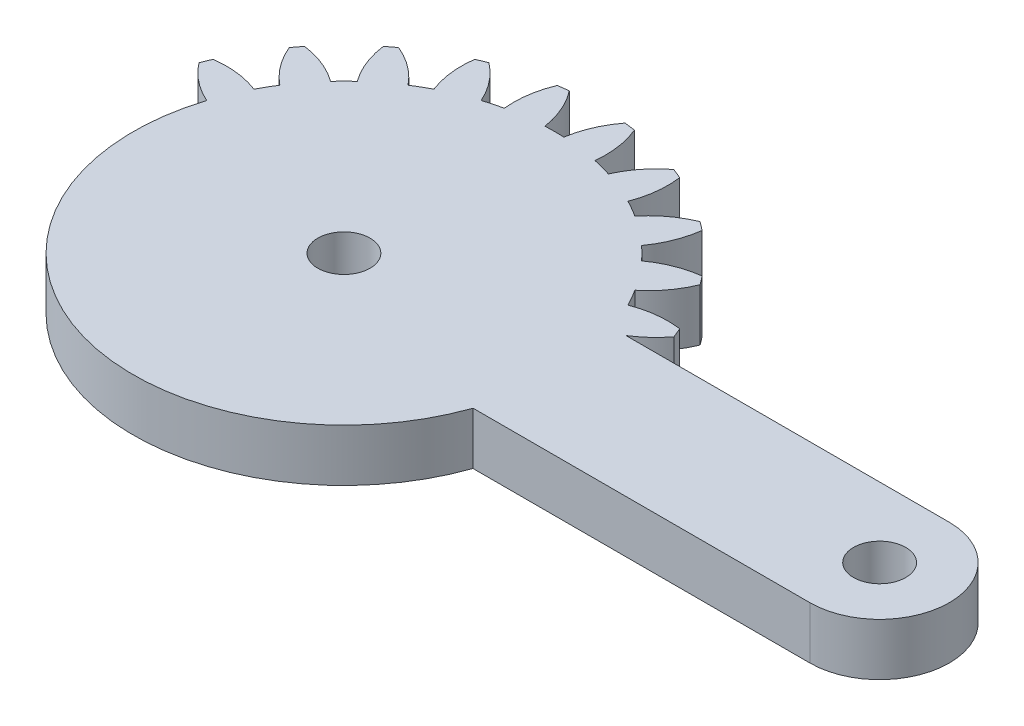
from build123d import *
from build123d.topology import SkipClean

# Parameters (mm, degrees)
SKETCH1_R           = 1.5
BOSS_EXTRUDE1_DEPTH = 3
CUT_EXTRUDE1_START  = -10
CUT_EXTRUDE1_DEPTH  = 10
SCALE1_SCALE        = 2


with BuildPart() as part:
    # Sketch1 → Boss-Extrude1 (new body)
    with BuildSketch(Plane(origin=(0, 0, 0), x_dir=(1, 0, 0), z_dir=(0, 1, 0))):
        with BuildLine():
            Line((20.643657446, 4), (2.081641936, 4))
            ThreePointArc((2.081641936, 4), (2.861028333, 4.588201733), (3.521749436, 5.30713988))
            ThreePointArc((3.521749436, 5.30713988), (3.405395609, 5.596745198), (3.282888305, 5.883801663))
            ThreePointArc((3.282888305, 5.883801663), (1.93527598, 5.894040025), (0.627094961, 5.57027124))
            ThreePointArc((0.627094961, 5.57027124), (0.366286148, 6.046375), (0.084372603, 6.510293938))
            ThreePointArc((0.084372603, 6.510293938), (1.018855105, 7.48132754), (1.683794586, 8.65351323))
            ThreePointArc((1.683794586, 8.65351323), (1.496450048, 8.903135899), (1.303821399, 9.148703928))
            ThreePointArc((1.303821399, 9.148703928), (-0.000522033, 8.809805691), (-1.180330337, 8.158486898))
            ThreePointArc((-1.180330337, 8.158486898), (-1.555477026, 8.550865528), (-1.947855656, 8.926012217))
            ThreePointArc((-1.947855656, 8.926012217), (-1.296536862, 10.105820521), (-0.957638625, 11.410163953))
            ThreePointArc((-0.957638625, 11.410163953), (-1.203206655, 11.602792602), (-1.452829324, 11.79013714))
            ThreePointArc((-1.452829324, 11.79013714), (-2.625015014, 11.125197659), (-3.596048616, 10.190715157))
            ThreePointArc((-3.596048616, 10.190715157), (-4.059967554, 10.472628702), (-4.536071314, 10.733437515))
            ThreePointArc((-4.536071314, 10.733437515), (-4.212302529, 12.041618533), (-4.222540891, 13.389230859))
            ThreePointArc((-4.222540891, 13.389230859), (-4.509597355, 13.511738163), (-4.799202674, 13.62809199))
            ThreePointArc((-4.799202674, 13.62809199), (-5.759348103, 12.682425791), (-6.455432668, 11.528463019))
            ThreePointArc((-6.455432668, 11.528463019), (-6.976508546, 11.680699536), (-7.503891752, 11.809396783))
            ThreePointArc((-7.503891752, 11.809396783), (-7.529737283, 13.156800143), (-7.888414517, 14.455843809))
            ThreePointArc((-7.888414517, 14.455843809), (-8.197396993, 14.499881098), (-8.507248835, 14.537314892))
            ThreePointArc((-8.507248835, 14.537314892), (-9.18992168, 13.375367565), (-9.563620196, 12.080565177))
            ThreePointArc((-9.563620196, 12.080565177), (-10.106342554, 12.09275), (-10.649064912, 12.080565177))
            ThreePointArc((-10.649064912, 12.080565177), (-11.022763428, 13.375367565), (-11.705436272, 14.537314892))
            ThreePointArc((-11.705436272, 14.537314892), (-12.015288115, 14.499881098), (-12.324270591, 14.455843809))
            ThreePointArc((-12.324270591, 14.455843809), (-12.682947825, 13.156800143), (-12.708793355, 11.809396783))
            ThreePointArc((-12.708793355, 11.809396783), (-13.236176561, 11.680699536), (-13.757252439, 11.528463019))
            ThreePointArc((-13.757252439, 11.528463019), (-14.453337005, 12.682425791), (-15.413482434, 13.62809199))
            ThreePointArc((-15.413482434, 13.62809199), (-15.703087752, 13.511738163), (-15.990144217, 13.389230859))
            ThreePointArc((-15.990144217, 13.389230859), (-16.000382579, 12.041618533), (-15.676613793, 10.733437515))
            ThreePointArc((-15.676613793, 10.733437515), (-16.152717554, 10.472628702), (-16.616636492, 10.190715157))
            ThreePointArc((-16.616636492, 10.190715157), (-17.587670094, 11.125197659), (-18.759855783, 11.79013714))
            ThreePointArc((-18.759855783, 11.79013714), (-19.009478453, 11.602792602), (-19.255046482, 11.410163953))
            ThreePointArc((-19.255046482, 11.410163953), (-18.916148245, 10.105820521), (-18.264829452, 8.926012217))
            ThreePointArc((-18.264829452, 8.926012217), (-18.657208082, 8.550865528), (-19.032354771, 8.158486898))
            ThreePointArc((-19.032354771, 8.158486898), (-20.212163074, 8.809805691), (-21.516506507, 9.148703928))
            ThreePointArc((-21.516506507, 9.148703928), (-21.709135156, 8.903135899), (-21.896479694, 8.65351323))
            ThreePointArc((-21.896479694, 8.65351323), (-21.231540213, 7.48132754), (-20.297057711, 6.510293938))
            ThreePointArc((-20.297057711, 6.510293938), (-20.578971255, 6.046375), (-20.839780068, 5.57027124))
            ThreePointArc((-20.839780068, 5.57027124), (-22.147961087, 5.894040025), (-23.495573413, 5.883801663))
            ThreePointArc((-23.495573413, 5.883801663), (-23.618080717, 5.596745198), (-23.734434544, 5.30713988))
            ThreePointArc((-23.734434544, 5.30713988), (-22.788768345, 4.346994451), (-21.634805572, 3.650909885))
            ThreePointArc((-21.634805572, 3.650909885), (-21.78704209, 3.129834008), (-21.915739337, 2.602450802))
            ThreePointArc((-21.915739337, 2.602450802), (-23.263142697, 2.576605271), (-24.562186363, 2.217928037))
            ThreePointArc((-24.562186363, 2.217928037), (-24.606223651, 1.908945561), (-24.643657446, 1.599093719))
            ThreePointArc((-24.643657446, 1.599093719), (-23.481710119, 0.916420874), (-22.186907731, 0.542722358))
            ThreePointArc((-22.186907731, 0.542722358), (-22.199092554, 0), (-22.186907731, -0.542722358))
            ThreePointArc((-22.186907731, -0.542722358), (-23.481710119, -0.916420874), (-24.643657446, -1.599093719))
            ThreePointArc((-24.643657446, -1.599093719), (-24.606223651, -1.908945561), (-24.562186363, -2.217928037))
            ThreePointArc((-24.562186363, -2.217928037), (-23.263142697, -2.576605271), (-21.915739337, -2.602450802))
            ThreePointArc((-21.915739337, -2.602450802), (-21.78704209, -3.129834008), (-21.634805572, -3.650909885))
            ThreePointArc((-21.634805572, -3.650909885), (-22.788768345, -4.346994451), (-23.734434544, -5.30713988))
            ThreePointArc((-23.734434544, -5.30713988), (-23.618080717, -5.596745198), (-23.495573413, -5.883801663))
            ThreePointArc((-23.495573413, -5.883801663), (-22.147961087, -5.894040025), (-20.839780068, -5.57027124))
            ThreePointArc((-20.839780068, -5.57027124), (-20.578971255, -6.046375), (-20.297057711, -6.510293938))
            ThreePointArc((-20.297057711, -6.510293938), (-21.231540213, -7.48132754), (-21.896479694, -8.65351323))
            ThreePointArc((-21.896479694, -8.65351323), (-21.709135156, -8.903135899), (-21.516506507, -9.148703928))
            ThreePointArc((-21.516506507, -9.148703928), (-20.212163074, -8.809805691), (-19.032354771, -8.158486898))
            ThreePointArc((-19.032354771, -8.158486898), (-18.657208082, -8.550865528), (-18.264829452, -8.926012217))
            ThreePointArc((-18.264829452, -8.926012217), (-18.916148245, -10.105820521), (-19.255046482, -11.410163953))
            ThreePointArc((-19.255046482, -11.410163953), (-19.009478453, -11.602792602), (-18.759855783, -11.79013714))
            ThreePointArc((-18.759855783, -11.79013714), (-17.587670094, -11.125197659), (-16.616636492, -10.190715157))
            ThreePointArc((-16.616636492, -10.190715157), (-16.152717554, -10.472628702), (-15.676613793, -10.733437515))
            ThreePointArc((-15.676613793, -10.733437515), (-16.000382579, -12.041618533), (-15.990144217, -13.389230859))
            ThreePointArc((-15.990144217, -13.389230859), (-15.703087752, -13.511738163), (-15.413482434, -13.62809199))
            ThreePointArc((-15.413482434, -13.62809199), (-14.453337005, -12.682425791), (-13.757252439, -11.528463019))
            ThreePointArc((-13.757252439, -11.528463019), (-13.236176561, -11.680699536), (-12.708793355, -11.809396783))
            ThreePointArc((-12.708793355, -11.809396783), (-12.682947825, -13.156800143), (-12.324270591, -14.455843809))
            ThreePointArc((-12.324270591, -14.455843809), (-12.015288115, -14.499881098), (-11.705436272, -14.537314892))
            ThreePointArc((-11.705436272, -14.537314892), (-11.022763428, -13.375367565), (-10.649064912, -12.080565177))
            ThreePointArc((-10.649064912, -12.080565177), (-10.106342554, -12.09275), (-9.563620196, -12.080565177))
            ThreePointArc((-9.563620196, -12.080565177), (-9.18992168, -13.375367565), (-8.507248835, -14.537314892))
            ThreePointArc((-8.507248835, -14.537314892), (-8.197396993, -14.499881098), (-7.888414517, -14.455843809))
            ThreePointArc((-7.888414517, -14.455843809), (-7.529737283, -13.156800143), (-7.503891752, -11.809396783))
            ThreePointArc((-7.503891752, -11.809396783), (-6.976508546, -11.680699536), (-6.455432668, -11.528463019))
            ThreePointArc((-6.455432668, -11.528463019), (-5.759348103, -12.682425791), (-4.799202674, -13.62809199))
            ThreePointArc((-4.799202674, -13.62809199), (-4.509597355, -13.511738163), (-4.222540891, -13.389230859))
            ThreePointArc((-4.222540891, -13.389230859), (-4.212302529, -12.041618533), (-4.536071314, -10.733437515))
            ThreePointArc((-4.536071314, -10.733437515), (-4.059967554, -10.472628702), (-3.596048616, -10.190715157))
            ThreePointArc((-3.596048616, -10.190715157), (-2.625015014, -11.125197659), (-1.452829324, -11.79013714))
            ThreePointArc((-1.452829324, -11.79013714), (-1.203206655, -11.602792602), (-0.957638625, -11.410163953))
            ThreePointArc((-0.957638625, -11.410163953), (-1.296536862, -10.105820521), (-1.947855656, -8.926012217))
            ThreePointArc((-1.947855656, -8.926012217), (-1.555477026, -8.550865528), (-1.180330337, -8.158486898))
            ThreePointArc((-1.180330337, -8.158486898), (-0.000522033, -8.809805691), (1.303821399, -9.148703928))
            ThreePointArc((1.303821399, -9.148703928), (1.496450048, -8.903135899), (1.683794586, -8.65351323))
            ThreePointArc((1.683794586, -8.65351323), (1.018855105, -7.48132754), (0.084372603, -6.510293938))
            ThreePointArc((0.084372603, -6.510293938), (0.366286148, -6.046375), (0.627094961, -5.57027124))
            ThreePointArc((0.627094961, -5.57027124), (1.93527598, -5.894040025), (3.282888305, -5.883801663))
            ThreePointArc((3.282888305, -5.883801663), (3.405395609, -5.596745198), (3.521749436, -5.30713988))
            ThreePointArc((3.521749436, -5.30713988), (2.861028333, -4.588201733), (2.081641936, -4))
            Line((2.081641936, -4), (20.643657446, -4))
            ThreePointArc((20.643657446, -4), (24.643657446, 0), (20.643657446, 4))
        make_face()
        with Locations(Location((-10.106342554, 0, 0), (0, 0, 270))):
            Circle(SKETCH1_R, mode=Mode.SUBTRACT)
        with Locations(Location((20.643657446, 0, 0), (0, 0, 270))):
            Circle(SKETCH1_R, mode=Mode.SUBTRACT)
    extrude(amount=BOSS_EXTRUDE1_DEPTH)

    # Sketch2 → Cut-Extrude1 (cut)
    with SkipClean():  # the faces are left unmerged after this step: merging them gives an invalid solid
        with BuildSketch(Plane(origin=(0, 3, 0), x_dir=(1, 0, 0), z_dir=(0, 1, 0)).offset(CUT_EXTRUDE1_START)):
            with BuildLine():
                ThreePointArc((-24.562186363, -2.217928037), (-23.263142697, -2.576605271), (-21.915739337, -2.602450802))
                ThreePointArc((-21.915739337, -2.602450802), (-22.095637401, -1.578420611), (-22.186907731, -0.542722358))
                ThreePointArc((-22.186907731, -0.542722358), (-23.481710119, -0.916420874), (-24.643657446, -1.599093719))
                ThreePointArc((-24.643657446, -1.599093719), (-24.606223651, -1.908945561), (-24.562186363, -2.217928037))
            make_face()
            with BuildLine():
                ThreePointArc((-23.495573413, -5.883801663), (-22.147961087, -5.894040025), (-20.839780068, -5.57027124))
                ThreePointArc((-20.839780068, -5.57027124), (-21.278586771, -4.627695077), (-21.634805572, -3.650909885))
                ThreePointArc((-21.634805572, -3.650909885), (-22.788768345, -4.346994451), (-23.734434544, -5.30713988))
                ThreePointArc((-23.734434544, -5.30713988), (-23.618080717, -5.596745198), (-23.495573413, -5.883801663))
            make_face()
            with BuildLine():
                ThreePointArc((-21.516506507, -9.148703928), (-20.212163074, -8.809805691), (-19.032354771, -8.158486898))
                ThreePointArc((-19.032354771, -8.158486898), (-19.70016616, -7.361599771), (-20.297057711, -6.510293938))
                ThreePointArc((-20.297057711, -6.510293938), (-21.231540213, -7.48132754), (-21.896479694, -8.65351323))
                ThreePointArc((-21.896479694, -8.65351323), (-21.709135156, -8.903135899), (-21.516506507, -9.148703928))
            make_face()
            with BuildLine():
                ThreePointArc((-18.759855783, -11.79013714), (-17.587670094, -11.125197659), (-16.616636492, -10.190715157))
                ThreePointArc((-16.616636492, -10.190715157), (-17.467942324, -9.593823606), (-18.264829452, -8.926012217))
                ThreePointArc((-18.264829452, -8.926012217), (-18.916148245, -10.105820521), (-19.255046482, -11.410163953))
                ThreePointArc((-19.255046482, -11.410163953), (-19.009478453, -11.602792602), (-18.759855783, -11.79013714))
            make_face()
            with BuildLine():
                ThreePointArc((-15.413482434, -13.62809199), (-14.453337005, -12.682425791), (-13.757252439, -11.528463019))
                ThreePointArc((-13.757252439, -11.528463019), (-14.734037631, -11.172244217), (-15.676613793, -10.733437515))
                ThreePointArc((-15.676613793, -10.733437515), (-16.000382579, -12.041618533), (-15.990144217, -13.389230859))
                ThreePointArc((-15.990144217, -13.389230859), (-15.703087752, -13.511738163), (-15.413482434, -13.62809199))
            make_face()
            with BuildLine():
                ThreePointArc((-11.705436272, -14.537314892), (-11.022763428, -13.375367565), (-10.649064912, -12.080565177))
                ThreePointArc((-10.649064912, -12.080565177), (-11.684763165, -11.989294847), (-12.708793355, -11.809396783))
                ThreePointArc((-12.708793355, -11.809396783), (-12.682947825, -13.156800143), (-12.324270591, -14.455843809))
                ThreePointArc((-12.324270591, -14.455843809), (-12.015288115, -14.499881098), (-11.705436272, -14.537314892))
            make_face()
            with BuildLine():
                ThreePointArc((-7.888414517, -14.455843809), (-7.529737283, -13.156800143), (-7.503891752, -11.809396783))
                ThreePointArc((-7.503891752, -11.809396783), (-8.527921943, -11.989294847), (-9.563620196, -12.080565177))
                ThreePointArc((-9.563620196, -12.080565177), (-9.18992168, -13.375367565), (-8.507248835, -14.537314892))
                ThreePointArc((-8.507248835, -14.537314892), (-8.197396993, -14.499881098), (-7.888414517, -14.455843809))
            make_face()
            with BuildLine():
                ThreePointArc((-4.222540891, -13.389230859), (-4.212302529, -12.041618533), (-4.536071314, -10.733437515))
                ThreePointArc((-4.536071314, -10.733437515), (-5.478647477, -11.172244217), (-6.455432668, -11.528463019))
                ThreePointArc((-6.455432668, -11.528463019), (-5.759348103, -12.682425791), (-4.799202674, -13.62809199))
                ThreePointArc((-4.799202674, -13.62809199), (-4.509597355, -13.511738163), (-4.222540891, -13.389230859))
            make_face()
            with BuildLine():
                ThreePointArc((-0.957638625, -11.410163953), (-1.296536862, -10.105820521), (-1.947855656, -8.926012217))
                ThreePointArc((-1.947855656, -8.926012217), (-2.744742783, -9.593823606), (-3.596048616, -10.190715157))
                ThreePointArc((-3.596048616, -10.190715157), (-2.625015014, -11.125197659), (-1.452829324, -11.79013714))
                ThreePointArc((-1.452829324, -11.79013714), (-1.203206655, -11.602792602), (-0.957638625, -11.410163953))
            make_face()
            with BuildLine():
                ThreePointArc((1.683794586, -8.65351323), (1.018855105, -7.48132754), (0.084372603, -6.510293938))
                ThreePointArc((0.084372603, -6.510293938), (-0.512518948, -7.361599771), (-1.180330337, -8.158486898))
                ThreePointArc((-1.180330337, -8.158486898), (-0.000522033, -8.809805691), (1.303821399, -9.148703928))
                ThreePointArc((1.303821399, -9.148703928), (1.496450048, -8.903135899), (1.683794586, -8.65351323))
            make_face()
            with BuildLine():
                ThreePointArc((3.521749436, -5.30713988), (2.861028333, -4.588201733), (2.081641936, -4))
                Line((2.081641936, -4), (1.305695063, -4))
                ThreePointArc((1.305695063, -4), (0.994195953, -4.797149927), (0.627094961, -5.57027124))
                ThreePointArc((0.627094961, -5.57027124), (1.93527598, -5.894040025), (3.282888305, -5.883801663))
                ThreePointArc((3.282888305, -5.883801663), (3.405395609, -5.596745198), (3.521749436, -5.30713988))
            make_face()
            with BuildLine():
                ThreePointArc((-22.186907731, 0.542722358), (-22.095637401, 1.578420611), (-21.915739337, 2.602450802))
                ThreePointArc((-21.915739337, 2.602450802), (-23.263142697, 2.576605271), (-24.562186363, 2.217928037))
                ThreePointArc((-24.562186363, 2.217928037), (-24.606223651, 1.908945561), (-24.643657446, 1.599093719))
                ThreePointArc((-24.643657446, 1.599093719), (-23.481710119, 0.916420874), (-22.186907731, 0.542722358))
            make_face()
        extrude(amount=CUT_EXTRUDE1_DEPTH, mode=Mode.SUBTRACT)


with BuildPart() as part_1:
    # Scale1: scaled about (-4.338876576, 1.5, -0.590548785)
    add(part.part.scale(SCALE1_SCALE).moved(Location((4.338876576, -1.5, 0.590548785))))


solid = part_1.part
